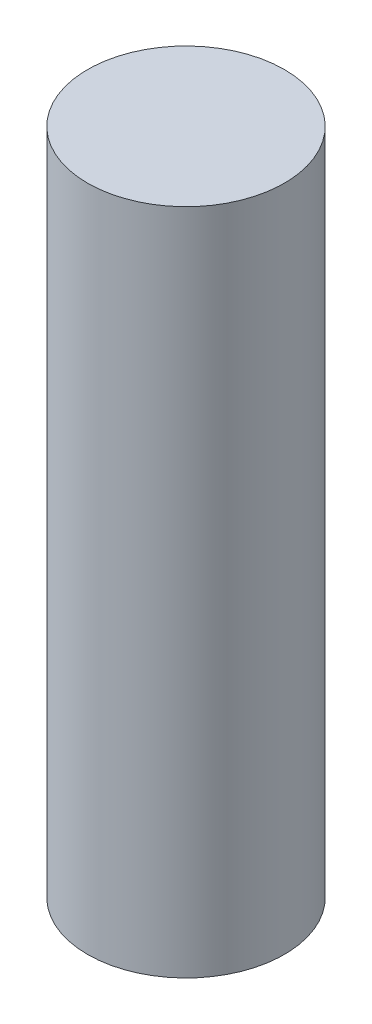
from build123d import *

# Parameters (mm, degrees)
SKETCH1_R           = 1.4
BOSS_EXTRUDE1_DEPTH = 9.5


with BuildPart() as part:
    # Sketch1 → Boss-Extrude1 (new body)
    with BuildSketch(Plane(origin=(0, 0, 0), x_dir=(1, 0, 0), z_dir=(0, 1, 0))):
        with Locations(Location((0, 0, 0), (0, 0, 270))):
            Circle(SKETCH1_R)
    extrude(amount=BOSS_EXTRUDE1_DEPTH)


solid = part.part
